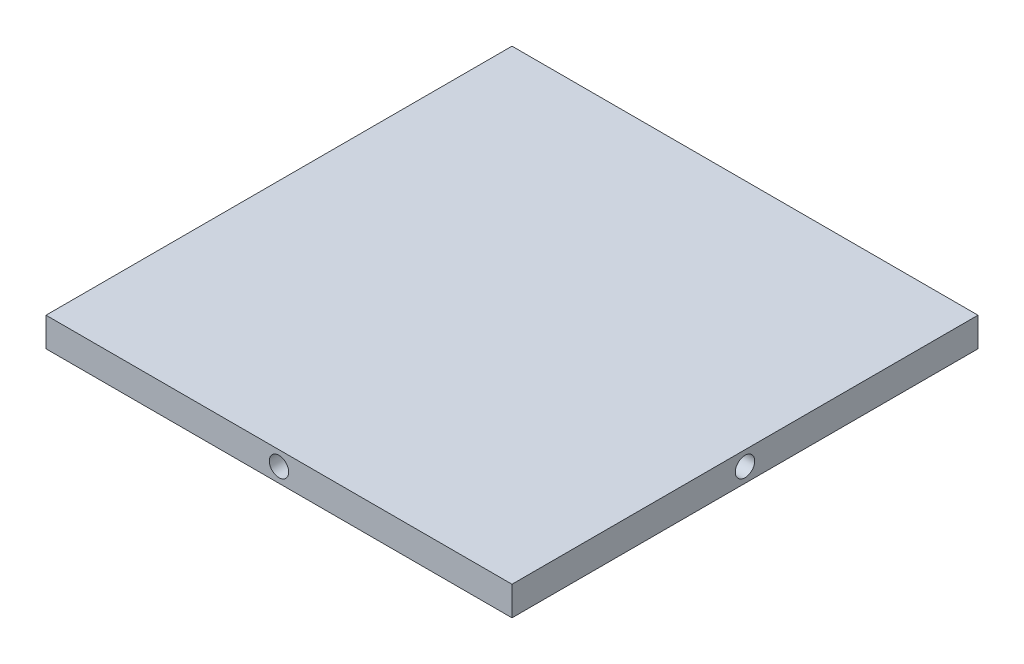
from build123d import *

# Parameters (mm, degrees)
SKETCH1_W           = 152.4
SKETCH1_H           = 152.4
BOSS_EXTRUDE1_DEPTH = 4.7625
CIRPATTERN1_COUNT   = 4


with BuildPart() as part:
    # Sketch1 → Boss-Extrude1 (new, symmetric)
    with BuildSketch(Plane(origin=(0, 0, 0), x_dir=(1, 0, 0), z_dir=(0, 1, 0))):
        Rectangle(SKETCH1_W, SKETCH1_H)
    extrude(amount=BOSS_EXTRUDE1_DEPTH, both=True)

    # Sketch3 → 1/4 (0.25) Diameter Hole1 (revolve, cut)
    with BuildSketch(Plane(origin=(76.2, 0, 0), x_dir=(0, 0, -1), z_dir=(0, 1, 0))):
        Polygon((0, 0), (0, 14.607732465), (3.175, 12.7), (3.175, 0), align=None)
    f_1_4_0_25_diameter_hole1 = revolve(axis=Axis((82.55, 0, 0), (-1, 0, 0)), mode=Mode.SUBTRACT)

    # CirPattern1: 1/4 (0.25) Diameter Hole1 ×4 about axis
    cirpattern1_axis = Axis((0, 4.7625, 0), (0, 1, 0))
    for i in range(1, CIRPATTERN1_COUNT):
        add(f_1_4_0_25_diameter_hole1.rotate(cirpattern1_axis, i * 360 / CIRPATTERN1_COUNT), mode=Mode.SUBTRACT)


solid = part.part
